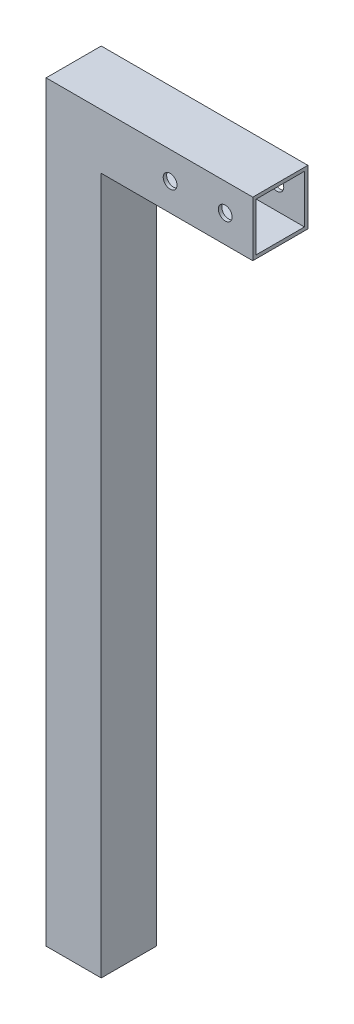
from build123d import *

# Parameters (mm, degrees)
SKETCH1_W           = 25.4
SKETCH1_H           = 25.4
SKETCH1_W_2         = 22.225
SKETCH1_H_2         = 22.225
BOSS_EXTRUDE1_DEPTH = 321.23
SKETCH2_W           = 25.4
SKETCH2_H           = 25.4
SKETCH2_W_2         = 22.225
SKETCH2_H_2         = 22.225
BOSS_EXTRUDE2_DEPTH = 95.25
SKETCH3_R           = 3.175
CUT_EXTRUDE1_DEPTH  = 358.228245524


with BuildPart() as part:
    # Sketch1 → Boss-Extrude1 (new body)
    with BuildSketch(Plane(origin=(0, 0, 0), x_dir=(1, 0, 0), z_dir=(0, 1, 0))):
        Rectangle(SKETCH1_W, SKETCH1_H)
        Rectangle(SKETCH1_W_2, SKETCH1_H_2, mode=Mode.SUBTRACT)
    extrude(amount=BOSS_EXTRUDE1_DEPTH)

    # Sketch2 → Boss-Extrude2 (add)
    with BuildSketch(Plane.ZY.offset(12.7)):
        with Locations((0, 333.93)):
            Rectangle(SKETCH2_W, SKETCH2_H)
        with Locations((0, 333.93)):
            Rectangle(SKETCH2_W_2, SKETCH2_H_2, mode=Mode.SUBTRACT)
    extrude(amount=-BOSS_EXTRUDE2_DEPTH)

    # Sketch3 → Cut-Extrude1 (cut, through all)
    with BuildSketch(Plane.XY.offset(12.7)):
        with Locations((44.45, 333.93)):
            Circle(SKETCH3_R)
        with Locations((69.85, 333.93)):
            Circle(SKETCH3_R)
    extrude(amount=-CUT_EXTRUDE1_DEPTH, mode=Mode.SUBTRACT)


solid = part.part
